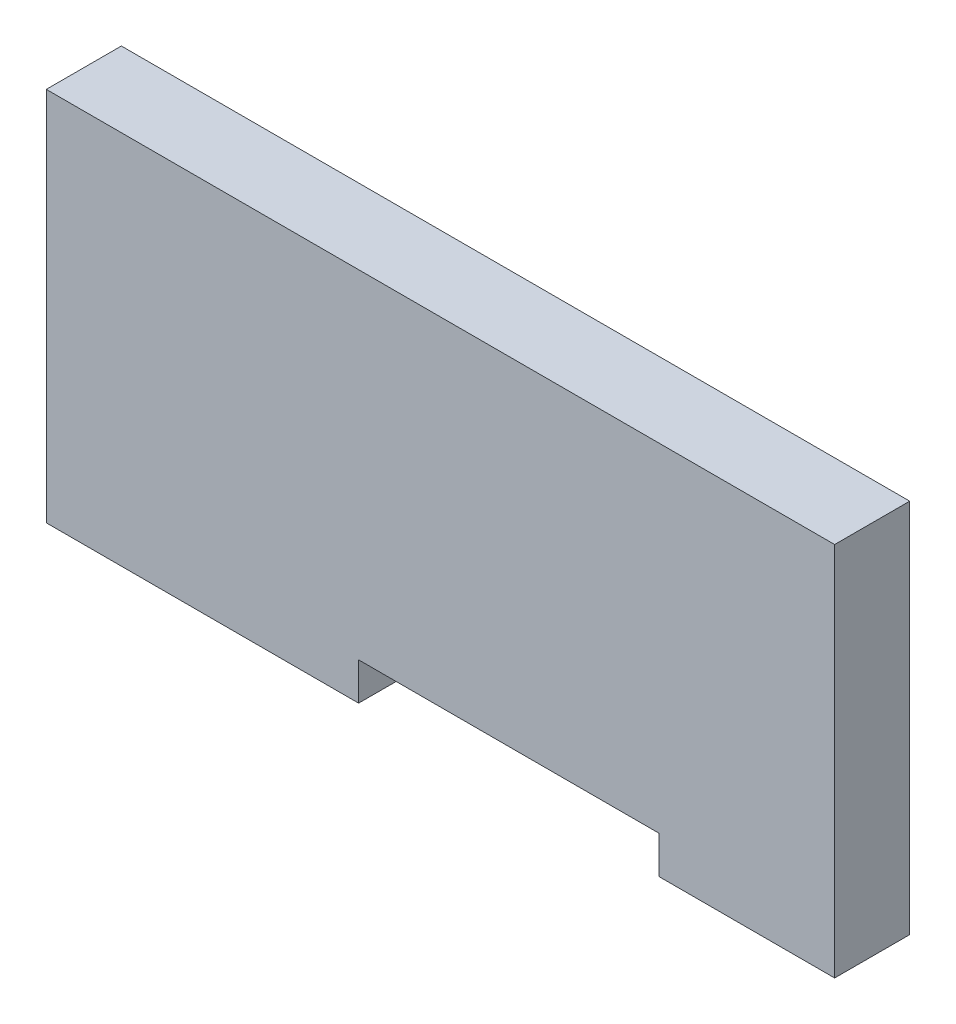
from build123d import *

# Parameters (mm, degrees)
BOSS_EXTRUDE1_DEPTH = 20


with BuildPart() as part:
    # Sketch1 → Boss-Extrude1 (new body)
    with BuildSketch(Plane.XY):
        Polygon((-21.8, -50), (-105, -50), (-105, 50), (105, 50), (105, -50), (58.2, -50), (58.2, -40), (-21.8, -40), align=None)
    extrude(amount=BOSS_EXTRUDE1_DEPTH)


solid = part.part
